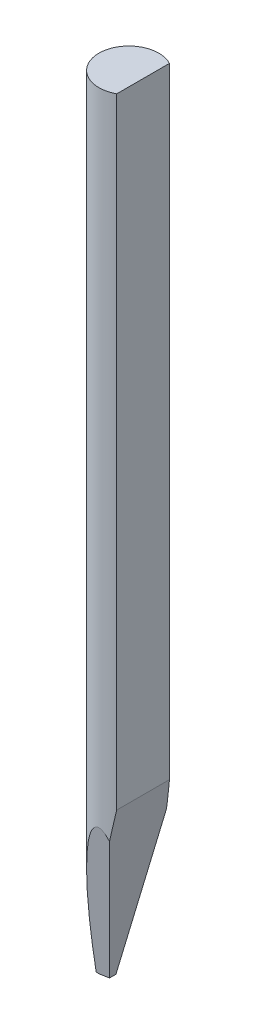
from build123d import *

# Parameters (mm, degrees)
TD_SKETCH_R                           = 0.79248
TL_FEATURE_DEPTH                      = 21.0312
TDF_180_DEG_REV_SKETCH_W              = 1.60495996
TDF_180_DEG_REV_SKETCH_H              = 1.60495996
TDF_180_DEG_REV_FEATURE_DEPTH         = 22.061040395
ISA_20_180_DEG_REV_FEATURE_DEPTH      = 22.061040395
ISA_20_180_DEG_REV_FEATURE_DEPTH_BACK = 22.061040395
F_10BA_180_DEG_REV_FEATURE_DEPTH      = 22.061040395
F_10BA_180_DEG_REV_FEATURE_DEPTH_BACK = 22.061040395


with BuildPart() as part:
    # TD_sketch → TL_feature (new body)
    with BuildSketch(Plane(origin=(0, 0, 0), x_dir=(1, 0, 0), z_dir=(0, 1, 0))):
        Circle(TD_SKETCH_R)
    extrude(amount=TL_FEATURE_DEPTH)

    # TDF_180_DEG_REV_sketch → TDF_180_DEG_REV_feature (cut, through all)
    with BuildSketch(Plane(origin=(0, 0, 0), x_dir=(1, 0, 0), z_dir=(0, 1, 0))):
        with Locations((1.17839998, 0)):
            Rectangle(TDF_180_DEG_REV_SKETCH_W, TDF_180_DEG_REV_SKETCH_H)
    extrude(amount=TDF_180_DEG_REV_FEATURE_DEPTH, mode=Mode.SUBTRACT)

    # ISA_20_180_DEG_REV_sketch → ISA_20_180_DEG_REV_feature (cut, two sides: drawn at the far end of the back side and taken through both)
    with BuildSketch(Plane(origin=(0, 0, 0), x_dir=(0, 0, -1), z_dir=(1, 0, 0)).offset(-ISA_20_180_DEG_REV_FEATURE_DEPTH_BACK)):
        Polygon((-12.996080373, 73.27228267), (-3.784567997, 21.0312), (-0.0762, 0), (0.0762, 0), (3.784567997, 21.0312), (12.996080373, 73.27228267), (12.996080373, -32.821688483), (-12.996080373, -32.821688483), align=None)
    extrude(amount=ISA_20_180_DEG_REV_FEATURE_DEPTH + ISA_20_180_DEG_REV_FEATURE_DEPTH_BACK, mode=Mode.SUBTRACT)

    # 10BA_180_DEG_REV_sketch → 10BA_180_DEG_REV_feature (cut, two sides: drawn at the far end of the back side and taken through both)
    with BuildSketch(Plane.XY.offset(-F_10BA_180_DEG_REV_FEATURE_DEPTH_BACK)):
        Polygon((-53.632984634, 0), (-0.79248, 0), (-0.71628, 0), (-0.427914365, 0.050846642), (3.271487997, 21.0312), (12.447145333, 73.068938636), (90.829329802, 2.18375769), (24.749199835, -70.885180946), align=None)
    extrude(amount=F_10BA_180_DEG_REV_FEATURE_DEPTH + F_10BA_180_DEG_REV_FEATURE_DEPTH_BACK, mode=Mode.SUBTRACT)


solid = part.part
